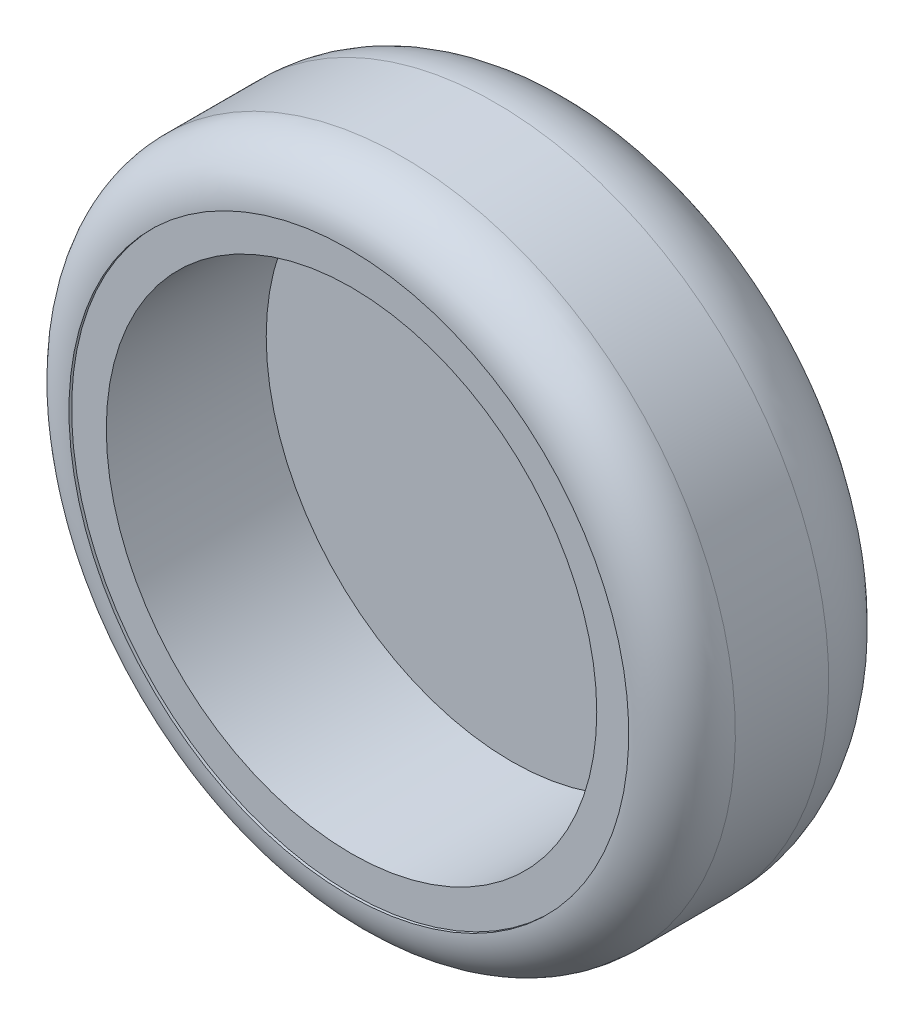
from build123d import *


with BuildPart() as part:
    # 草图2 → 旋转2 (revolve)
    with BuildSketch(Plane(origin=(0, 0, 0), x_dir=(0, 0, -1), z_dir=(1, 0, 0)), mode=Mode.PRIVATE) as revolve_2_sk:
        with BuildLine():
            Line((1.6, 0), (4.5, 0))
            Line((4.5, 0), (4.5, 9))
            ThreePointArc((4.5, 9), (3.474873734, 11.474873734), (1, 12.5))
            Line((1, 12.5), (-2.5, 12.5))
            ThreePointArc((-2.5, 12.5), (-3.914213562, 11.914213562), (-4.5, 10.5))
            Line((-4.5, 10.5), (-4.4, 10.5))
            Line((-4.4, 10.5), (-4.4, 9.2))
            Line((-4.4, 9.2), (1.6, 9.2))
            Line((1.6, 9.2), (1.6, 0))
        make_face()
    revolve(revolve_2_sk.sketch.rotate(Axis((0, 0, -1.6), (0, 0, -1)), 180), axis=Axis((0, 0, -1.6), (0, 0, -1)))


solid = part.part
